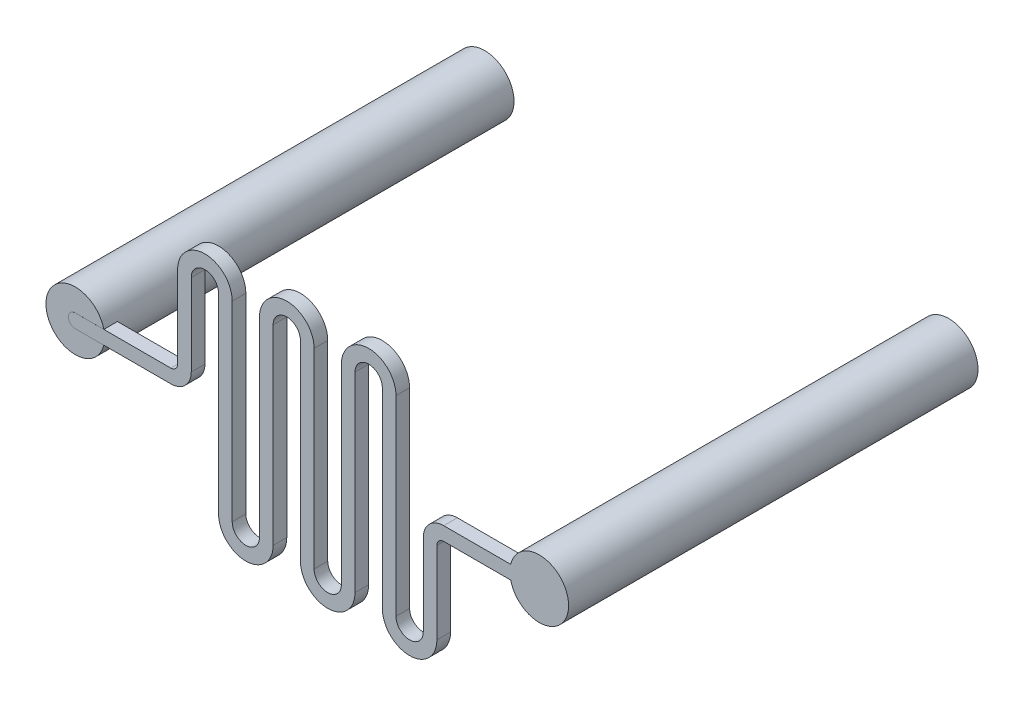
from build123d import *

# Parameters (mm, degrees)
BOSS_EXTRUDE1_DEPTH = 1
SKETCH3_W           = 2.15
SKETCH3_H           = 30
SKETCH4_W           = 2.15
SKETCH4_H           = 30
SKETCH5_R           = 1.5
CUT_EXTRUDE1_DEPTH  = 28
SKETCH6_R           = 1.5
CUT_EXTRUDE2_DEPTH  = 28


with BuildPart() as part:
    # Sketch2 → Boss-Extrude1 (new body)
    with BuildSketch(Plane.XY):
        with BuildLine():
            Line((-20.5, -0.5), (-13.5, -0.5))
            ThreePointArc((-13.5, -0.5), (-12.439339828, -0.060660172), (-12, 1))
            Line((-12, 1), (-12, 7))
            ThreePointArc((-12, 7), (-11, 8), (-10, 7))
            Line((-10, 7), (-10, 0))
            Line((-10, 0), (-10, -7))
            ThreePointArc((-10, -7), (-8, -9), (-6, -7))
            Line((-6, -7), (-6, 0))
            Line((-6, 0), (-6, 7))
            ThreePointArc((-6, 7), (-5, 8), (-4, 7))
            Line((-4, 7), (-4, 0))
            Line((-4, 0), (-4, -7))
            ThreePointArc((-4, -7), (-2, -9), (0, -7))
            Line((0, -7), (0, 0))
            Line((0, 0), (0, 7))
            ThreePointArc((0, 7), (1, 8), (2, 7))
            Line((2, 7), (2, 0))
            Line((2, 0), (2, -7))
            ThreePointArc((2, -7), (4, -9), (6, -7))
            Line((6, -7), (6, -1))
            ThreePointArc((6, -1), (6.146446609, -0.646446609), (6.5, -0.5))
            Line((6.5, -0.5), (13.5, -0.5))
            ThreePointArc((13.5, -0.5), (14, 0), (13.5, 0.5))
            Line((13.5, 0.5), (6.5, 0.5))
            ThreePointArc((6.5, 0.5), (5.439339828, 0.060660172), (5, -1))
            Line((5, -1), (5, -7))
            ThreePointArc((5, -7), (4, -8), (3, -7))
            Line((3, -7), (3, 0))
            Line((3, 0), (3, 7))
            ThreePointArc((3, 7), (1, 9), (-1, 7))
            Line((-1, 7), (-1, 0))
            Line((-1, 0), (-1, -7))
            ThreePointArc((-1, -7), (-2, -8), (-3, -7))
            Line((-3, -7), (-3, 0))
            Line((-3, 0), (-3, 7))
            ThreePointArc((-3, 7), (-5, 9), (-7, 7))
            Line((-7, 7), (-7, 0))
            Line((-7, 0), (-7, -7))
            ThreePointArc((-7, -7), (-8, -8), (-9, -7))
            Line((-9, -7), (-9, 0))
            Line((-9, 0), (-9, 7))
            ThreePointArc((-9, 7), (-11, 9), (-13, 7))
            Line((-13, 7), (-13, 1))
            ThreePointArc((-13, 1), (-13.146446609, 0.646446609), (-13.5, 0.5))
            Line((-13.5, 0.5), (-20.5, 0.5))
            ThreePointArc((-20.5, 0.5), (-21, 0), (-20.5, -0.5))
        make_face()
    extrude(amount=BOSS_EXTRUDE1_DEPTH)

    # Sketch3 → Revolve1 (revolve)
    with BuildSketch(Plane(origin=(0, 0, 0), x_dir=(1, 0, 0), z_dir=(0, 1, 0)), mode=Mode.PRIVATE) as revolve1_sk:
        with Locations((-21.575, 14.001632273)):
            Rectangle(SKETCH3_W, SKETCH3_H)
    revolve(revolve1_sk.sketch.rotate(Axis((-20.5, 0, 0.998367727), (0, 0, -1)), 180), axis=Axis((-20.5, 0, 0.998367727), (0, 0, -1)))

    # Sketch4 → Revolve2 (revolve)
    with BuildSketch(Plane(origin=(0, 0, 0), x_dir=(1, 0, 0), z_dir=(0, 1, 0))):
        with Locations((14.575, 14)):
            Rectangle(SKETCH4_W, SKETCH4_H)
    revolve(axis=Axis((13.5, 0, 1), (0, 0, -1)))

    # Sketch5 → Cut-Extrude1 (cut)
    with BuildSketch(Plane(origin=(0, 0, -29), x_dir=(-1, 0, 0), z_dir=(0, 0, -1))):
        with Locations((-13.5, 0)):
            Circle(SKETCH5_R)
        with Locations((20.5, 0)):
            Circle(SKETCH5_R)
    extrude(amount=-CUT_EXTRUDE1_DEPTH, mode=Mode.SUBTRACT)

    # Sketch6 → Cut-Extrude2 (cut)
    with BuildSketch(Plane(origin=(0, 0, -29.001632273), x_dir=(-1, 0, 0), z_dir=(0, 0, -1))):
        with Locations((20.5, 0)):
            Circle(SKETCH6_R)
    extrude(amount=-CUT_EXTRUDE2_DEPTH, mode=Mode.SUBTRACT)


solid = part.part
